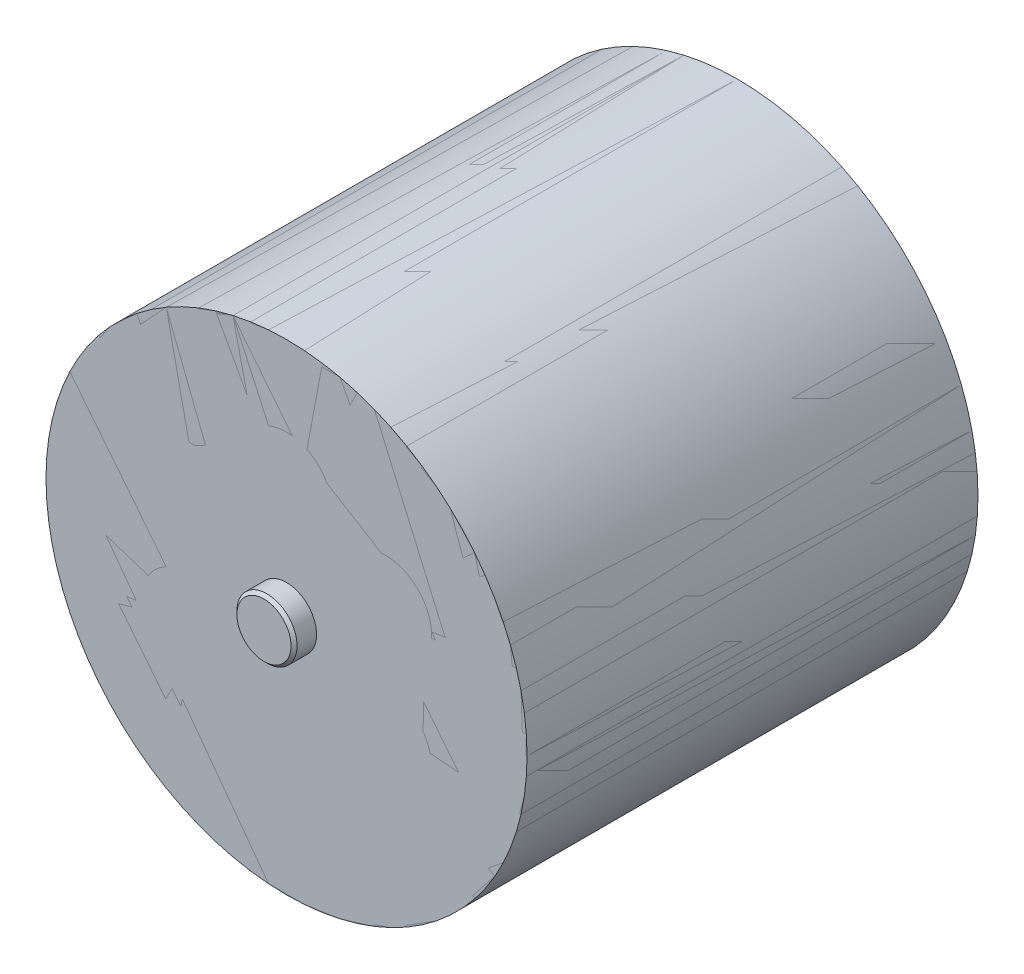
from build123d import *

# Parameters (mm, degrees)
SKETCH1_R               = 160
BOSS_EXTRUDE1_DEPTH     = 150
SKETCH2_R               = 30.583998029
CUT_EXTRUDE1_DEPTH      = 5
CIRPATTERN1_COUNT       = 6
MIRROR1_COPY_1_SKETCH_R = 30.583998029
MIRROR1_COPY_1_DEPTH    = 5
MIRROR1_COPY_2_SKETCH_R = 30.583998029
MIRROR1_COPY_2_DEPTH    = 5
MIRROR1_COPY_3_SKETCH_R = 30.583998029
MIRROR1_COPY_3_DEPTH    = 5
MIRROR1_COPY_4_SKETCH_R = 30.583998029
MIRROR1_COPY_4_DEPTH    = 5
MIRROR1_COPY_5_SKETCH_R = 30.583998029
MIRROR1_COPY_5_DEPTH    = 5
SKETCH3_R               = 20
BOSS_EXTRUDE2_DEPTH     = 15
CHAMFER1_SIZE           = 2
SKETCH4_R               = 160
BOSS_EXTRUDE3_DEPTH     = 300


with BuildPart() as part:
    # Sketch1 → Boss-Extrude1 (new, symmetric)
    with BuildSketch(Plane.XY):
        with Locations((271.211975439, 413.994449049)):
            Circle(SKETCH1_R)
    extrude(amount=BOSS_EXTRUDE1_DEPTH, both=True)

    # Sketch2 → Cut-Extrude1 (cut)
    with BuildSketch(Plane.XY.offset(150)):
        with Locations((271.211975439, 490.065575896)):
            Circle(SKETCH2_R)
    cut_extrude1 = extrude(amount=-CUT_EXTRUDE1_DEPTH, mode=Mode.SUBTRACT)

    # CirPattern1: Cut-Extrude1 ×6 about axis
    cirpattern1_axis = Axis((271.211975439, 413.994449049, 0), (0, 0, 1))
    for i in range(1, CIRPATTERN1_COUNT):
        add(cut_extrude1.rotate(cirpattern1_axis, i * 360 / CIRPATTERN1_COUNT), mode=Mode.SUBTRACT)

    # Mirror1: Cut-Extrude1 across plane
    add(cut_extrude1.mirror(Plane.XY), mode=Mode.SUBTRACT)

    # Mirror1 copy 1 sketch → Mirror1 copy 1 (cut)
    with BuildSketch(Plane(origin=(494.135697622, -27.879236016, -150), x_dir=(0.5000000000000001, 0.8660254037844386, 0), z_dir=(0, 0, -1))):
        with Locations((271.211975439, -490.065575896)):
            Circle(MIRROR1_COPY_1_SKETCH_R)
    extrude(amount=-MIRROR1_COPY_1_DEPTH, mode=Mode.SUBTRACT)

    # Mirror1 copy 2 sketch → Mirror1 copy 2 (cut)
    with BuildSketch(Plane(origin=(765.347673061, 386.115213033, -150), x_dir=(-0.4999999999999998, 0.8660254037844387, 0), z_dir=(0, 0, -1))):
        with Locations((271.211975439, -490.065575896)):
            Circle(MIRROR1_COPY_2_SKETCH_R)
    extrude(amount=-MIRROR1_COPY_2_DEPTH, mode=Mode.SUBTRACT)

    # Mirror1 copy 3 sketch → Mirror1 copy 3 (cut)
    with BuildSketch(Plane(origin=(542.423950878, 827.988898099, -150), x_dir=(-1, 0, 0), z_dir=(0, 0, -1))):
        with Locations((271.211975439, -490.065575896)):
            Circle(MIRROR1_COPY_3_SKETCH_R)
    extrude(amount=-MIRROR1_COPY_3_DEPTH, mode=Mode.SUBTRACT)

    # Mirror1 copy 4 sketch → Mirror1 copy 4 (cut)
    with BuildSketch(Plane(origin=(48.288253256, 855.868134114, -150), x_dir=(-0.5000000000000004, -0.8660254037844384, 0), z_dir=(0, 0, -1))):
        with Locations((271.211975439, -490.065575896)):
            Circle(MIRROR1_COPY_4_SKETCH_R)
    extrude(amount=-MIRROR1_COPY_4_DEPTH, mode=Mode.SUBTRACT)

    # Mirror1 copy 5 sketch → Mirror1 copy 5 (cut)
    with BuildSketch(Plane(origin=(-222.923722183, 441.873685065, -150), x_dir=(0.5000000000000001, -0.8660254037844386, 0), z_dir=(0, 0, -1))):
        with Locations((271.211975439, -490.065575896)):
            Circle(MIRROR1_COPY_5_SKETCH_R)
    extrude(amount=-MIRROR1_COPY_5_DEPTH, mode=Mode.SUBTRACT)

    # Sketch3 → Boss-Extrude2 (add)
    with BuildSketch(Plane.XY.offset(150)):
        with Locations((271.211975439, 413.994449049)):
            Circle(SKETCH3_R)
    boss_extrude2 = extrude(amount=BOSS_EXTRUDE2_DEPTH)

    # Chamfer1
    chamfer1_edges = [part.edges().sort_by_distance(p)[0] for p in [
        (251.211975439, 413.994449049, 165),
    ]]
    chamfer(chamfer1_edges, length=CHAMFER1_SIZE)

    # Mirror4: Boss-Extrude2 across plane
    add(boss_extrude2.mirror(Plane.XY))


with BuildPart() as body_2:
    # Sketch4 → Boss-Extrude3 (new body)
    with BuildSketch(Plane.XY.offset(150)):
        with Locations((271.211975439, 413.994449049)):
            Circle(SKETCH4_R)
    extrude(amount=-BOSS_EXTRUDE3_DEPTH)


solid = Compound([part.part, body_2.part])
